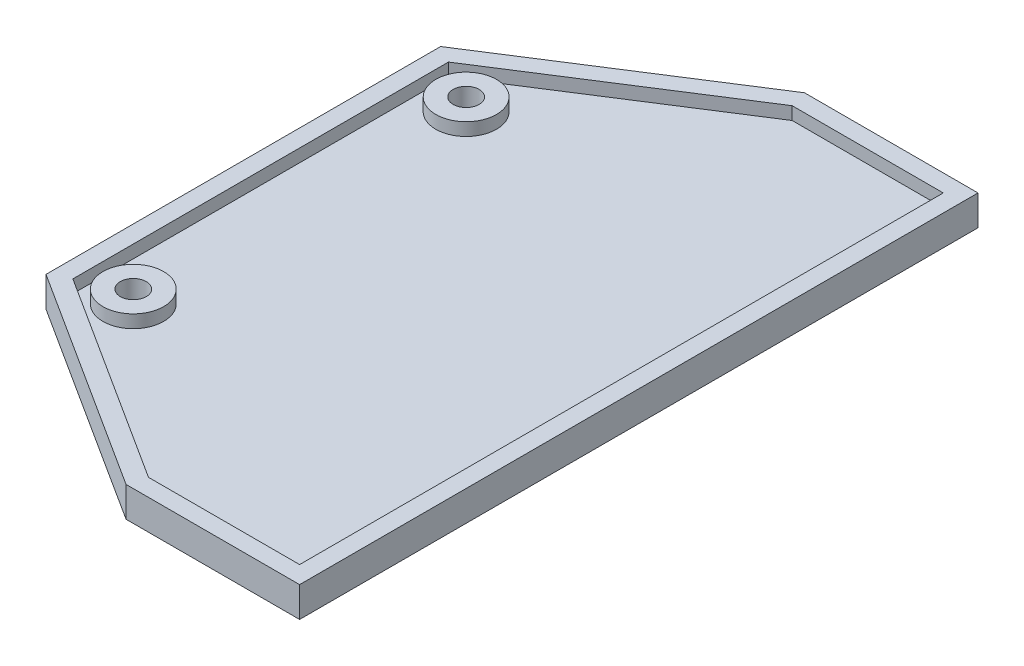
from build123d import *

# Parameters (mm, degrees)
SKETCH1_R           = 1.5
BOSS_EXTRUDE1_DEPTH = 3.48
SHELL1_T            = -2


with BuildPart() as part:
    # Sketch1 → Boss-Extrude1 (new body)
    with BuildSketch(Plane(origin=(0, 0, 0), x_dir=(1, 0, 0), z_dir=(0, 1, 0))):
        Polygon((84.974878237, 39.0892), (64.974878237, 39.0892), (39.398878237, 22.738080915), (39.398878237, -22.738080915), (64.974878237, -39.0892), (84.974878237, -39.0892), align=None)
        with Locations((45.898878237, 19.1788)):
            Circle(SKETCH1_R, mode=Mode.SUBTRACT)
        with Locations(Location((45.898878237, -19.1788, 0), (0, 0, 90))):
            Circle(SKETCH1_R, mode=Mode.SUBTRACT)
    extrude(amount=BOSS_EXTRUDE1_DEPTH)

    # Shell1
    shell1_openings = [part.faces().sort_by_distance(p)[0] for p in [
        (64.165608006, 3.48, 0),
    ]]
    offset(amount=SHELL1_T, openings=shell1_openings, kind=Kind.INTERSECTION)


solid = part.part
